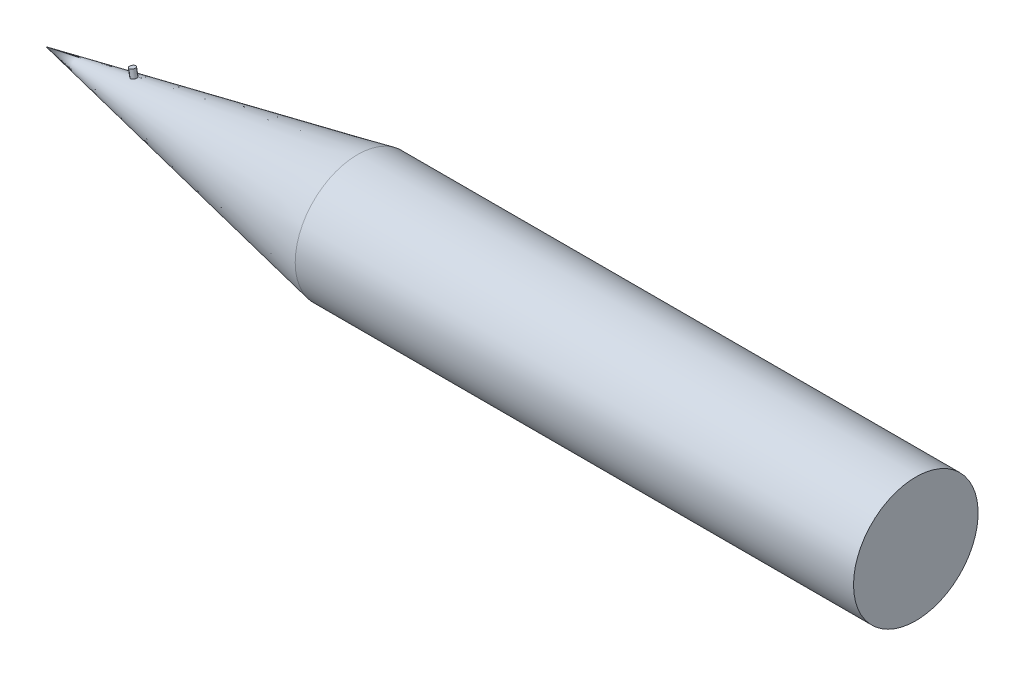
from build123d import *

# Parameters (mm, degrees)
SKETCH_2_R      = 0.15
EXTRUDE_1_DEPTH = 0.41
SKETCH_1_W      = 28.454402603
SKETCH_1_H      = 3.175138938


with BuildPart() as part:
    # 草圖2 → 填料-伸長1 (new body)
    with BuildSketch(Plane(origin=(0, 0, 0), x_dir=(0.9805804445574351, 0.19611729080206836, 0), z_dir=(-0.19611729080206836, 0.9805804445574351, 0))):
        with Locations(Location((4.572, 0, 0), (0, 0, 180))):
            Circle(SKETCH_2_R)
    extrude(amount=EXTRUDE_1_DEPTH)


with BuildPart() as body_2:
    # 草圖1 → 旋轉1 (revolve)
    with BuildSketch(Plane.XY, mode=Mode.PRIVATE) as revolve_1_sk:
        with Locations((30.102798699, 1.587569469)):
            Rectangle(SKETCH_1_W, SKETCH_1_H)
        Polygon((15.875597397, 3.175138938), (0, 0), (15.875597397, 0), align=None)
    revolve(revolve_1_sk.sketch.rotate(Axis((0, 0, 0), (1, 0, 0)), 90), axis=Axis((0, 0, 0), (1, 0, 0)))


solid = Compound([part.part, body_2.part])
